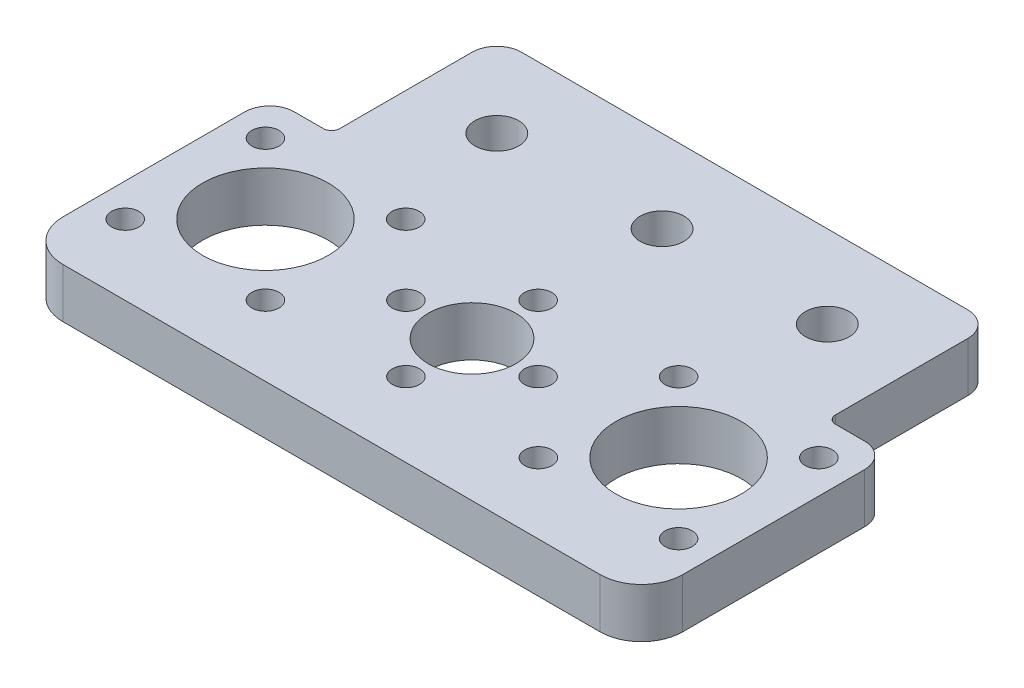
from build123d import *

# Parameters (mm, degrees)
SKETCH_1_R      = 1.65
SKETCH_1_R_2    = 7.6
SKETCH_1_R_3    = 5.3
SKETCH_1_R_4    = 2.65
EXTRUDE_1_DEPTH = 6
FILLET_1_R      = 3
FILLET_2_R      = 1


with BuildPart() as part:
    # 草图1 → 凸台-拉伸1 (new body)
    with BuildSketch(Plane(origin=(0, 0, 0), x_dir=(1, 0, 0), z_dir=(0, 1, 0))):
        with BuildLine():
            Line((-30, 13), (-37.5, 13))
            Line((-37.5, 13), (-37.5, -12))
            ThreePointArc((-37.5, -12), (-36.035533906, -15.535533906), (-32.5, -17))
            Line((-32.5, -17), (32.5, -17))
            ThreePointArc((32.5, -17), (36.035533906, -15.535533906), (37.5, -12))
            Line((37.5, -12), (37.5, 13))
            Line((37.5, 13), (30, 13))
            Line((30, 13), (30, 33))
            Line((30, 33), (-30, 33))
            Line((-30, 33), (-30, 13))
        make_face()
        with Locations(Location((-33.485281374, -8.485281374, 0), (0, 0, 270))):
            Circle(SKETCH_1_R, mode=Mode.SUBTRACT)
        with Locations(Location((-16.514718626, -8.485281374, 0), (0, 0, 270))):
            Circle(SKETCH_1_R, mode=Mode.SUBTRACT)
        with Locations(Location((0, -8, 0), (0, 0, 270))):
            Circle(SKETCH_1_R, mode=Mode.SUBTRACT)
        with Locations(Location((-25, 0, 0), (0, 0, 270))):
            Circle(SKETCH_1_R_2, mode=Mode.SUBTRACT)
        with Locations(Location((-8, 0, 0), (0, 0, 270))):
            Circle(SKETCH_1_R, mode=Mode.SUBTRACT)
        with Locations(Location((0, 0, 0), (0, 0, 270))):
            Circle(SKETCH_1_R_3, mode=Mode.SUBTRACT)
        with Locations(Location((0, 8, 0), (0, 0, 270))):
            Circle(SKETCH_1_R, mode=Mode.SUBTRACT)
        with Locations(Location((16.514718626, -8.485281374, 0), (0, 0, 270))):
            Circle(SKETCH_1_R, mode=Mode.SUBTRACT)
        with Locations(Location((33.485281374, -8.485281374, 0), (0, 0, 270))):
            Circle(SKETCH_1_R, mode=Mode.SUBTRACT)
        with Locations(Location((8, 0, 0), (0, 0, 270))):
            Circle(SKETCH_1_R, mode=Mode.SUBTRACT)
        with Locations(Location((25, 0, 0), (0, 0, 270))):
            Circle(SKETCH_1_R_2, mode=Mode.SUBTRACT)
        with Locations(Location((-33.485281374, 8.485281374, 0), (0, 0, 270))):
            Circle(SKETCH_1_R, mode=Mode.SUBTRACT)
        with Locations(Location((-16.514718626, 8.485281374, 0), (0, 0, 270))):
            Circle(SKETCH_1_R, mode=Mode.SUBTRACT)
        with Locations(Location((-20, 23, 0), (0, 0, 270))):
            Circle(SKETCH_1_R_4, mode=Mode.SUBTRACT)
        with Locations(Location((0, 23, 0), (0, 0, 270))):
            Circle(SKETCH_1_R_4, mode=Mode.SUBTRACT)
        with Locations(Location((16.514718626, 8.485281374, 0), (0, 0, 270))):
            Circle(SKETCH_1_R, mode=Mode.SUBTRACT)
        with Locations(Location((33.485281374, 8.485281374, 0), (0, 0, 270))):
            Circle(SKETCH_1_R, mode=Mode.SUBTRACT)
        with Locations(Location((20, 23, 0), (0, 0, 270))):
            Circle(SKETCH_1_R_4, mode=Mode.SUBTRACT)
    extrude(amount=EXTRUDE_1_DEPTH)

    # 圆角1
    fillet_1_edges = [part.edges().sort_by_distance(p)[0] for p in [
        (-37.5, 3, -13),
        (-30, 3, -33),
        (30, 3, -33),
        (37.5, 3, -13),
    ]]
    fillet(fillet_1_edges, radius=FILLET_1_R)

    # 圆角2
    fillet_2_edges = [part.edges().sort_by_distance(p)[0] for p in [
        (-30, 3, -13),
        (30, 3, -13),
    ]]
    fillet(fillet_2_edges, radius=FILLET_2_R)


solid = part.part
